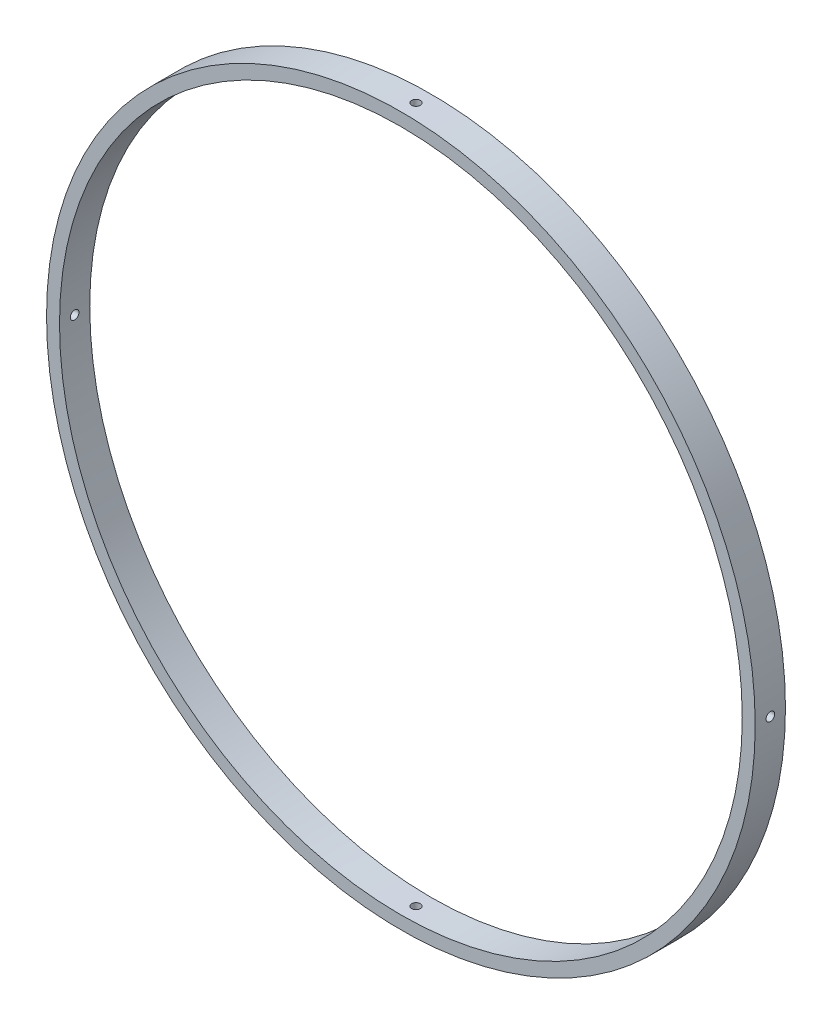
from build123d import *

# Parameters (mm, degrees)
SKETCH1_R           = 82
SKETCH1_R_2         = 79
BOSS_EXTRUDE1_DEPTH = 7
SKETCH2_R           = 1
CUT_EXTRUDE1_DEPTH  = 125
CIRPATTERN1_COUNT   = 4


with BuildPart() as part:
    # Sketch1 → Boss-Extrude1 (new body)
    with BuildSketch(Plane.XY):
        Circle(SKETCH1_R)
        Circle(SKETCH1_R_2, mode=Mode.SUBTRACT)
    extrude(amount=BOSS_EXTRUDE1_DEPTH)

    # Sketch2 → Cut-Extrude1 (cut)
    with BuildSketch(Plane(origin=(0, 0, 0), x_dir=(1, 0, 0), z_dir=(0, 1, 0))):
        with Locations(Location((0, -3.5, 0), (0, 0, 270))):
            Circle(SKETCH2_R)
    cut_extrude1 = extrude(amount=-CUT_EXTRUDE1_DEPTH, mode=Mode.SUBTRACT)

    # CirPattern1: Cut-Extrude1 ×4 about axis
    cirpattern1_axis = Axis((0, 0, 0), (0, 0, 1))
    for i in range(1, CIRPATTERN1_COUNT):
        add(cut_extrude1.rotate(cirpattern1_axis, i * 360 / CIRPATTERN1_COUNT), mode=Mode.SUBTRACT)


solid = part.part
